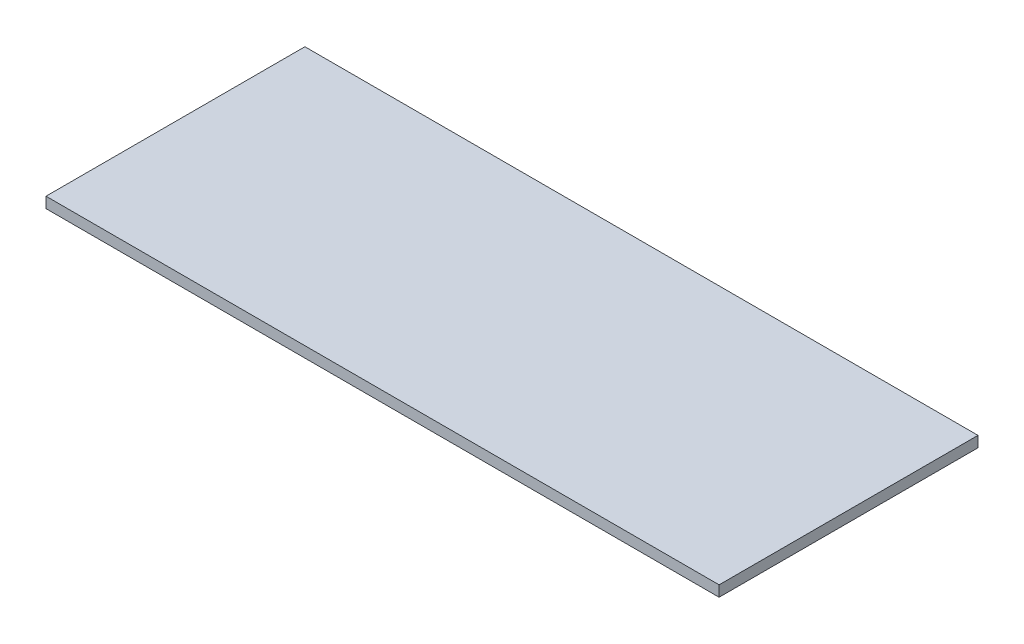
from build123d import *

# Parameters (mm, degrees)
SKETCH1_W           = 198.12
SKETCH1_H           = 76.2
BOSS_EXTRUDE1_DEPTH = 3.175


with BuildPart() as part:
    # Sketch1 → Boss-Extrude1 (new body)
    with BuildSketch(Plane(origin=(0, 0, 0), x_dir=(1, 0, 0), z_dir=(0, 1, 0))):
        with Locations((99.06, 38.1)):
            Rectangle(SKETCH1_W, SKETCH1_H)
    extrude(amount=BOSS_EXTRUDE1_DEPTH)


solid = part.part
